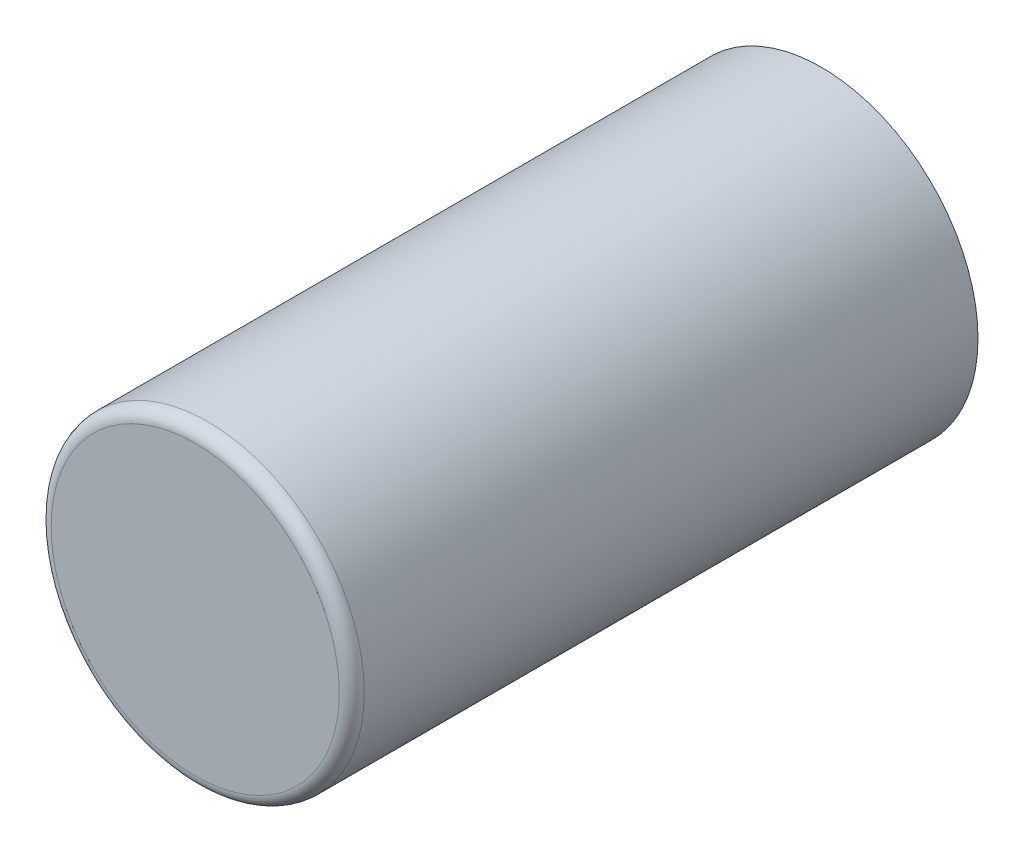
from build123d import *

# Parameters (mm, degrees)
SKETCH_1_R      = 25
EXTRUDE_1_DEPTH = 100
FILLET_1_R      = 2


with BuildPart() as part:
    # Эскиз1 → Бобышка-Вытянуть1 (new body)
    with BuildSketch(Plane.XY):
        Circle(SKETCH_1_R)
    extrude(amount=EXTRUDE_1_DEPTH)

    # Скругление1
    fillet_1_edges = [part.edges().sort_by_distance(p)[0] for p in [
        (-25, 0, 100),
    ]]
    fillet(fillet_1_edges, radius=FILLET_1_R)


solid = part.part
